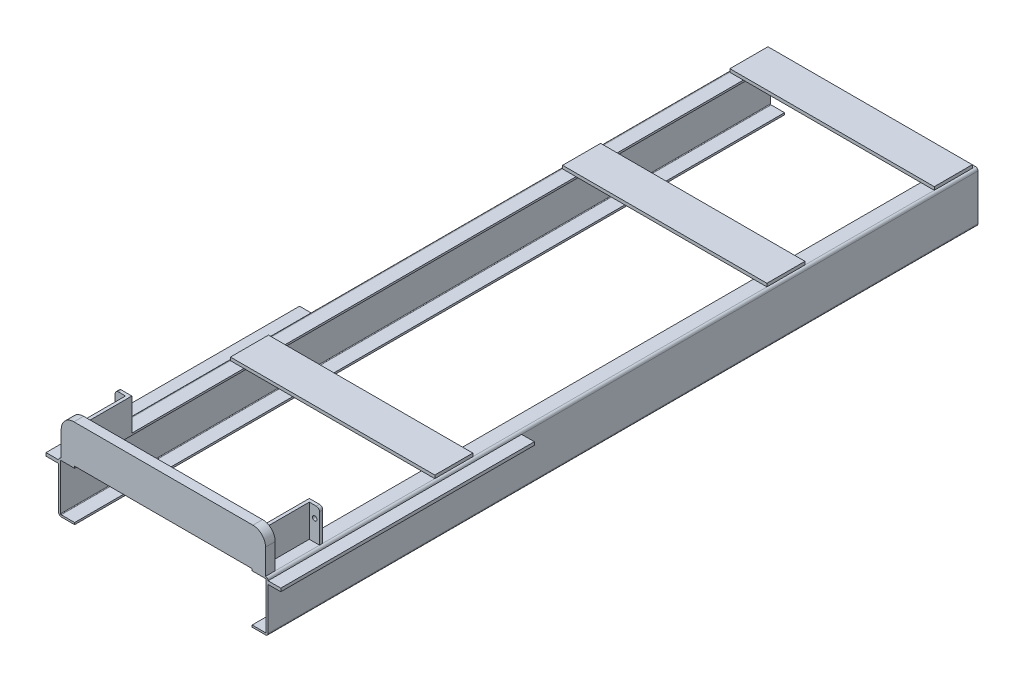
from build123d import *

# Parameters (mm, degrees)
EXTRUDE_THIN1_DEPTH  = 1400
SKETCH2_W            = 50
SKETCH2_H            = 12.5
BOSS_EXTRUDE1_DEPTH  = 1000
BOSS_EXTRUDE2_DEPTH  = 38
SKETCH5_W            = 806
SKETCH5_H            = 150
BOSS_EXTRUDE3_DEPTH  = 12.5
LPATTERN1_COUNT      = 2
LPATTERN1_PITCH      = 660
LPATTERN2_COUNT      = 2
LPATTERN2_PITCH      = 1970
SKETCH6_W            = 12.5
SKETCH6_H            = 127
BOSS_EXTRUDE4_DEPTH  = 175
SKETCH7_W            = 53
SKETCH7_H            = 127
SKETCH7_R            = 8.75
BOSS_EXTRUDE5_DEPTH  = 12.5
FILLET1_R            = 12.5
FILLET1_OF_MIRROR5_R = 12.5


with BuildPart() as part:
    # Sketch1 → Extrude-Thin1 (new, symmetric)
    with BuildSketch(Plane.XY):
        with BuildLine():
            Line((350, 100), (403, 100))
            ThreePointArc((403, 100), (410.071067812, 97.071067812), (413, 90))
            Line((413, 90), (413, -90))
            ThreePointArc((413, -90), (410.071067812, -97.071067812), (403, -100))
            Line((403, -100), (350, -100))
            Line((350, -100), (350, -92.5))
            Line((350, -92.5), (403, -92.5))
            ThreePointArc((403, -92.5), (404.767766953, -91.767766953), (405.5, -90))
            Line((405.5, -90), (405.5, 90))
            ThreePointArc((405.5, 90), (404.767766953, 91.767766953), (403, 92.5))
            Line((403, 92.5), (350, 92.5))
            Line((350, 92.5), (350, 100))
        make_face()
    extrude(amount=EXTRUDE_THIN1_DEPTH, both=True)

    # Sketch2 → Boss-Extrude1 (add)
    with BuildSketch(Plane.XY.offset(1400)):
        with Locations((438, 83.75)):
            Rectangle(SKETCH2_W, SKETCH2_H)
    extrude(amount=-BOSS_EXTRUDE1_DEPTH)


with BuildPart() as body_2:
    # Mirror4: mirrored copy
    add(part.part.mirror(Plane(origin=(0, 0, 0), x_dir=(0, 0, 1), z_dir=(1, 0, 0))))


with BuildPart() as part_1:
    add(part.part)

    add(body_2.part)  # Boss-Extrude2 merges body 2
    # Sketch4 → Boss-Extrude2 (add)
    with BuildSketch(Plane.XY.offset(1400)):
        with BuildLine():
            Line((-403, 100), (403, 100))
            Line((403, 100), (403, 200))
            ThreePointArc((403, 200), (388.355339059, 235.355339059), (353, 250))
            Line((353, 250), (-353, 250))
            ThreePointArc((-353, 250), (-388.355339059, 235.355339059), (-403, 200))
            Line((-403, 200), (-403, 100))
        make_face()
    extrude(amount=-BOSS_EXTRUDE2_DEPTH)

    # Sketch5 → Boss-Extrude3 (add)
    with BuildSketch(Plane(origin=(0, 100, 0), x_dir=(1, 0, 0), z_dir=(0, 1, 0))):
        with Locations((0, 1312.5)):
            Rectangle(SKETCH5_W, SKETCH5_H)
    boss_extrude3 = extrude(amount=BOSS_EXTRUDE3_DEPTH)

    # LPattern1: Boss-Extrude3 ×2
    with Locations(*[(0, 0, i * LPATTERN1_PITCH) for i in range(1, LPATTERN1_COUNT)]):
        add(boss_extrude3)

    # LPattern2: Boss-Extrude3 ×2
    with Locations(*[(0, 0, i * LPATTERN2_PITCH) for i in range(1, LPATTERN2_COUNT)]):
        add(boss_extrude3)

    # Sketch6 → Boss-Extrude4 (add)
    with BuildSketch(Plane(origin=(0, 0, 1362), x_dir=(-1, 0, 0), z_dir=(0, 0, -1))):
        with Locations((-356.25, 163.5)):
            Rectangle(SKETCH6_W, SKETCH6_H)
    boss_extrude4 = extrude(amount=BOSS_EXTRUDE4_DEPTH)

    # Sketch7 → Boss-Extrude5 (add)
    with BuildSketch(Plane(origin=(0, 0, 1187), x_dir=(-1, 0, 0), z_dir=(0, 0, -1))):
        with Locations((-376.5, 163.5)):
            Rectangle(SKETCH7_W, SKETCH7_H)
        with Locations((-384, 182)):
            Circle(SKETCH7_R, mode=Mode.SUBTRACT)
    boss_extrude5 = extrude(amount=BOSS_EXTRUDE5_DEPTH)

    # Fillet1
    fillet1_edges = [part_1.edges().sort_by_distance(p)[0] for p in [
        (403, 227, 1180.75),
    ]]
    fillet(fillet1_edges, radius=FILLET1_R)

    # Mirror5: Boss-Extrude4, Boss-Extrude5 across plane
    add(boss_extrude4.mirror(Plane(origin=(0, 0, 0), x_dir=(0, 0, 1), z_dir=(1, 0, 0))))
    add(boss_extrude5.mirror(Plane(origin=(0, 0, 0), x_dir=(0, 0, 1), z_dir=(1, 0, 0))))

    # Fillet1 of Mirror5
    fillet1_of_mirror5_edges = [part_1.edges().sort_by_distance(p)[0] for p in [
        (-403, 227, 1180.75),
    ]]
    fillet(fillet1_of_mirror5_edges, radius=FILLET1_OF_MIRROR5_R)


solid = part_1.part
